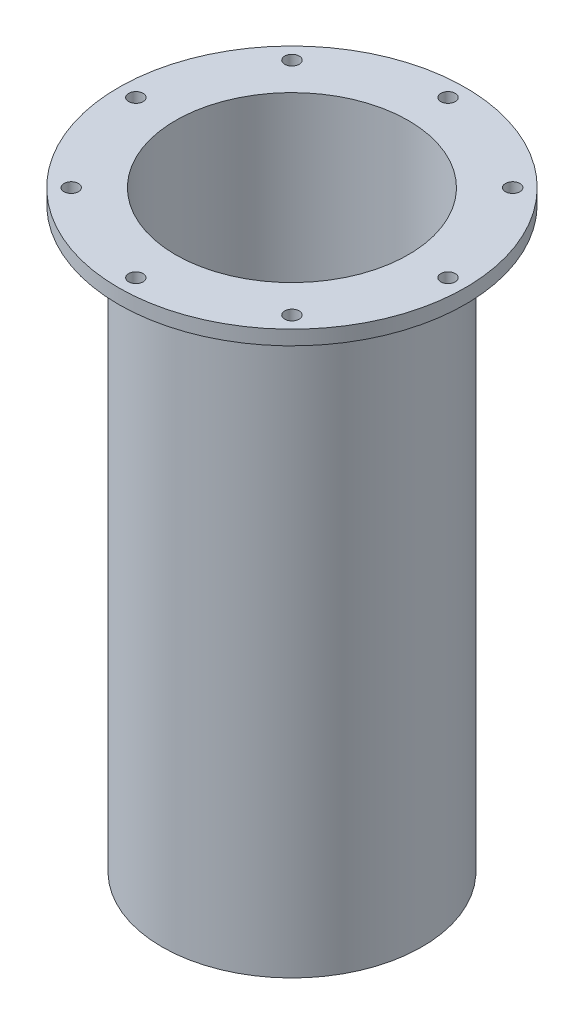
from build123d import *

# Parameters (mm, degrees)
SKETCH1_R                = 57.15
SKETCH1_R_2              = 51.1302
SCHEDULED_CHAMBER_DEPTH  = 260.35
SKETCH2_R                = 76.2
SKETCH2_R_2              = 54.102
FLANGE_DEPTH             = 6.35
ORIGINAL_BOLT_HOLE_REACH = 283.771
SKETCH3_R                = 3.175
BOLT_HOLE_PATTERN_COUNT  = 8


with BuildPart() as part:
    # Sketch1 → Scheduled Chamber (new body)
    with BuildSketch(Plane(origin=(0, 0, 0), x_dir=(1, 0, 0), z_dir=(0, 1, 0))):
        Circle(SKETCH1_R)
        Circle(SKETCH1_R_2, mode=Mode.SUBTRACT)
    extrude(amount=-SCHEDULED_CHAMBER_DEPTH)

    # Sketch2 → Flange (add)
    with BuildSketch(Plane(origin=(0, 0, 0), x_dir=(1, 0, 0), z_dir=(0, 1, 0))):
        Circle(SKETCH2_R)
        Circle(SKETCH2_R_2, mode=Mode.SUBTRACT)
    extrude(amount=-FLANGE_DEPTH)

    # Sketch3 → Original Bolt Hole (cut, up to next)
    with BuildSketch(Plane(origin=(0, 0, 0), x_dir=(1, 0, 0), z_dir=(0, 1, 0)), mode=Mode.PRIVATE) as original_bolt_hole_sk1:
        with Locations((0, 68.58)):
            Circle(SKETCH3_R)
    original_bolt_hole_tool1 = extrude(original_bolt_hole_sk1.sketch, amount=-ORIGINAL_BOLT_HOLE_REACH, mode=Mode.PRIVATE) & part.part
    original_bolt_hole = original_bolt_hole_tool1.solids().sort_by_distance((0, 0, -68.58))[0]
    add(original_bolt_hole, mode=Mode.SUBTRACT)

    # Bolt Hole Pattern: Original Bolt Hole ×8 about axis
    bolt_hole_pattern_axis = Axis((0, 55, 0), (0, -1, 0))
    for i in range(1, BOLT_HOLE_PATTERN_COUNT):
        add(original_bolt_hole.rotate(bolt_hole_pattern_axis, i * 360 / BOLT_HOLE_PATTERN_COUNT), mode=Mode.SUBTRACT)


solid = part.part
